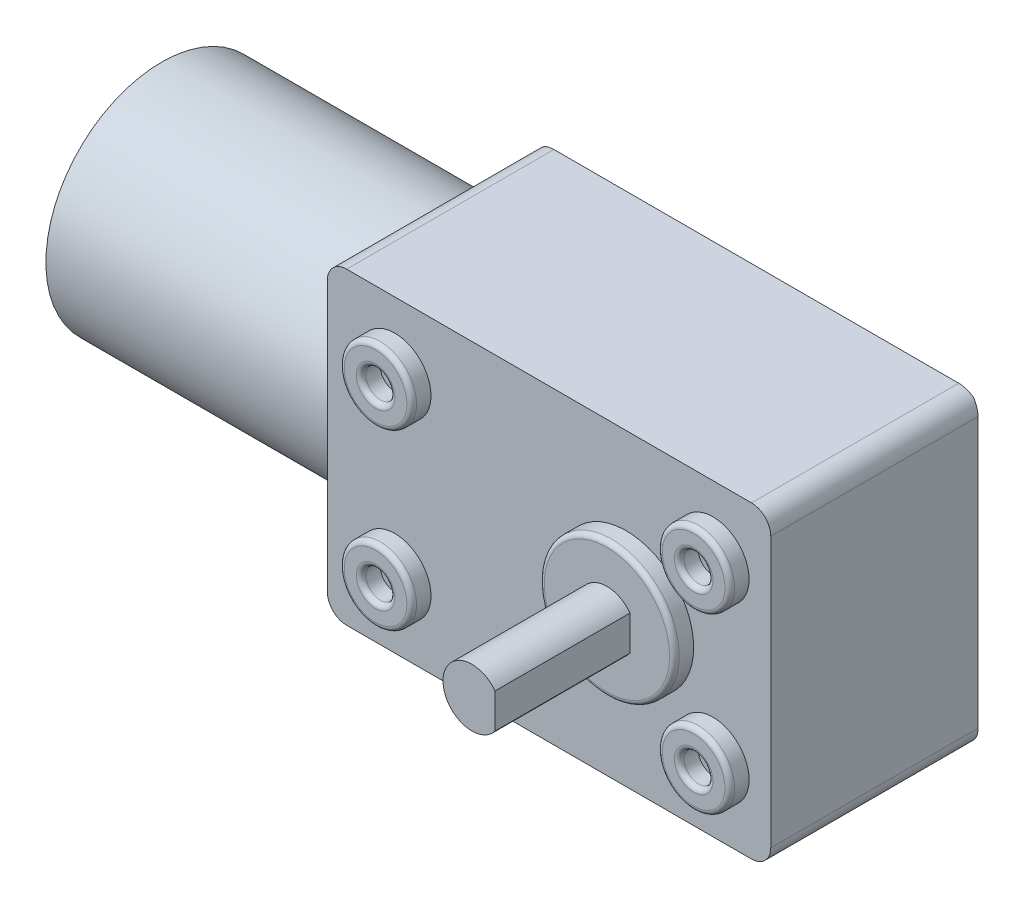
from build123d import *

# Parameters (mm, degrees)
SKETCH3_W           = 46
SKETCH3_H           = 32
BOSS_EXTRUDE1_DEPTH = 22.4
SKETCH4_R           = 3.75
SKETCH4_R_2         = 1.5
SKETCH4_R_3         = 7
BOSS_EXTRUDE3_DEPTH = 2
FILLET2_R           = 0.5
CHAMFER2_SIZE       = 5
CHAMFER2_SIZE2      = 0.9
FILLET3_R           = 2
SKETCH8_R           = 12
BOSS_EXTRUDE5_DEPTH = 30.2
SKETCH9_R           = 11.5
CUT_EXTRUDE1_DEPTH  = 1
BOSS_EXTRUDE6_DEPTH = 14


with BuildPart() as part:
    # Sketch3 → Boss-Extrude1 (new body)
    with BuildSketch(Plane.XY):
        Rectangle(SKETCH3_W, SKETCH3_H)
    extrude(amount=BOSS_EXTRUDE1_DEPTH)

    # Sketch4 → Boss-Extrude3 (add)
    # profile 1 of 5: a face of its own
    with BuildSketch(Plane.XY.offset(22.4)):
        with Locations((-16, 9)):
            Circle(SKETCH4_R)
        with Locations((-16, 9)):
            Circle(SKETCH4_R_2, mode=Mode.SUBTRACT)
    # profile 2 of 5: a face of its own
    with BuildSketch(Plane.XY.offset(22.4)):
        with Locations((-16, -9)):
            Circle(SKETCH4_R)
        with Locations((-16, -9)):
            Circle(SKETCH4_R_2, mode=Mode.SUBTRACT)
    # profile 3 of 5: a face of its own
    with BuildSketch(Plane.XY.offset(22.4)):
        with Locations((17, 9)):
            Circle(SKETCH4_R)
        with Locations((17, 9)):
            Circle(SKETCH4_R_2, mode=Mode.SUBTRACT)
    # profile 4 of 5: a face of its own
    with BuildSketch(Plane.XY.offset(22.4)):
        with Locations((17, -9)):
            Circle(SKETCH4_R)
        with Locations((17, -9)):
            Circle(SKETCH4_R_2, mode=Mode.SUBTRACT)
    # profile 5 of 5: a face of its own
    with BuildSketch(Plane.XY.offset(22.4)):
        with Locations((8, 0)):
            Circle(SKETCH4_R_3)
    extrude(amount=BOSS_EXTRUDE3_DEPTH)

    # Fillet2
    fillet2_edges = [part.edges().sort_by_distance(p)[0] for p in [
        (-19.75, 9, 24.4),
        (-17.5, 9, 24.4),
        (-19.75, -9, 24.4),
        (-17.5, -9, 24.4),
        (13.25, 9, 24.4),
        (15.5, 9, 24.4),
        (13.25, -9, 24.4),
        (15.5, -9, 24.4),
        (1, 0, 24.4),
    ]]
    fillet(fillet2_edges, radius=FILLET2_R)

    # Chamfer2
    chamfer2_edges = [part.edges().sort_by_distance(p)[0] for p in [
        (0, -16, 0),
        (0, 16, 0),
        (23, 0, 0),
    ]]
    chamfer2_side = [part.faces().sort_by_distance(p)[0] for p in [
        (0, 0, 0),
    ]]
    chamfer(chamfer2_edges, length=CHAMFER2_SIZE, length2=CHAMFER2_SIZE2, reference=chamfer2_side[0])

    # Fillet3
    fillet3_edges = [part.edges().sort_by_distance(p)[0] for p in [
        (23, -16, 11.65),
        (-23, -16, 11.65),
        (-23, 16, 11.65),
        (23, 16, 11.65),
    ]]
    fillet(fillet3_edges, radius=FILLET3_R)

    # Sketch8 → Boss-Extrude5 (add)
    with BuildSketch(Plane.ZY.offset(23)):
        with Locations(Location((9.4, 0, 0), (0, 0, 141.566793659))):
            Circle(SKETCH8_R)
    extrude(amount=BOSS_EXTRUDE5_DEPTH)

    # Sketch9 → Cut-Extrude1 (cut)
    with BuildSketch(Plane.ZY.offset(53.2)):
        with Locations(Location((9.817229221, 0, 0), (0, 0, 270))):
            Circle(SKETCH9_R)
    extrude(amount=-CUT_EXTRUDE1_DEPTH, mode=Mode.SUBTRACT)

    # Sketch10 → Boss-Extrude6 (add)
    with BuildSketch(Plane.XY.offset(24.4)):
        with BuildLine():
            Line((10.4, 1.8), (10.4, -1.8))
            ThreePointArc((10.4, -1.8), (5, 0), (10.4, 1.8))
        make_face()
    extrude(amount=BOSS_EXTRUDE6_DEPTH)


solid = part.part
